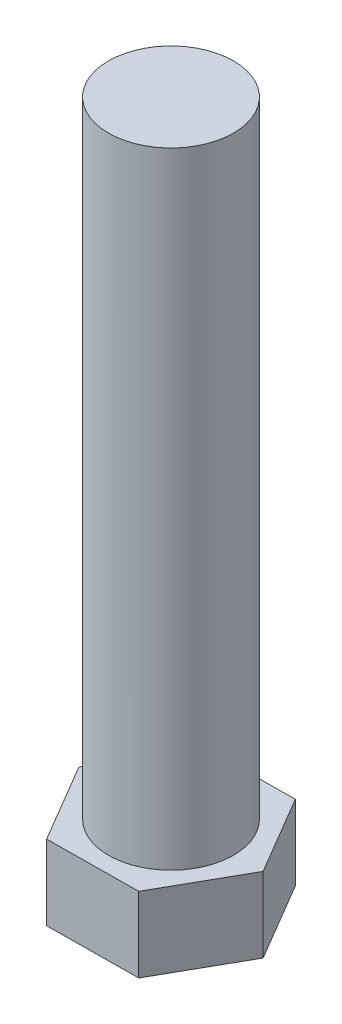
from build123d import *

# Parameters (mm, degrees)
SKETCH_1_R      = 5
EXTRUDE_1_DEPTH = 50
EXTRUDE_2_DEPTH = 6


with BuildPart() as part:
    # Эскиз1 → Бобышка-Вытянуть1 (new body)
    with BuildSketch(Plane(origin=(0, 0, 0), x_dir=(1, 0, 0), z_dir=(0, 1, 0))):
        with Locations(Location((0, 0, 0), (0, 0, 270))):
            Circle(SKETCH_1_R)
    extrude(amount=EXTRUDE_1_DEPTH)

    # Эскиз2 → Бобышка-Вытянуть2 (add)
    with BuildSketch(Plane.XZ):
        Polygon((3.706225124, 6.285050348), (-3.589900704, 6.352210283), (-7.296125827, 0.067159935), (-3.706225124, -6.285050348), (3.589900704, -6.352210283), (7.296125827, -0.067159935), align=None)
    extrude(amount=EXTRUDE_2_DEPTH)


solid = part.part
